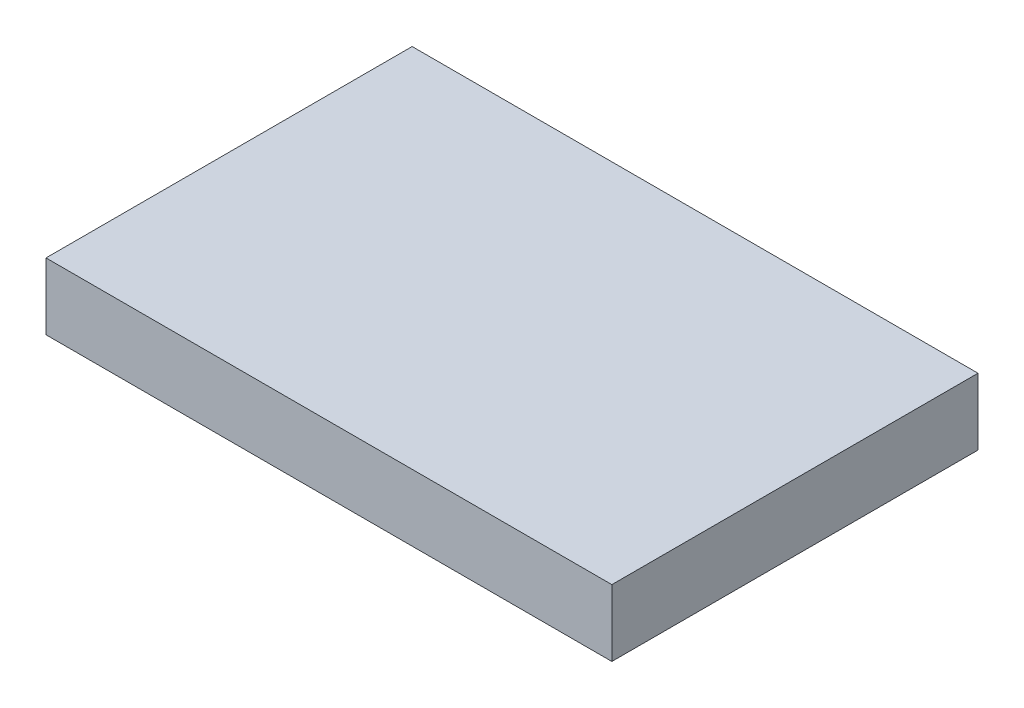
from build123d import *

# Parameters (mm, degrees)
SKETCH1_W           = 85
SKETCH1_H           = 55
BOSS_EXTRUDE1_DEPTH = 10


with BuildPart() as part:
    # Sketch1 → Boss-Extrude1 (new body)
    with BuildSketch(Plane(origin=(0, 0, 0), x_dir=(1, 0, 0), z_dir=(0, 1, 0))):
        Rectangle(SKETCH1_W, SKETCH1_H)
    extrude(amount=BOSS_EXTRUDE1_DEPTH)


solid = part.part
